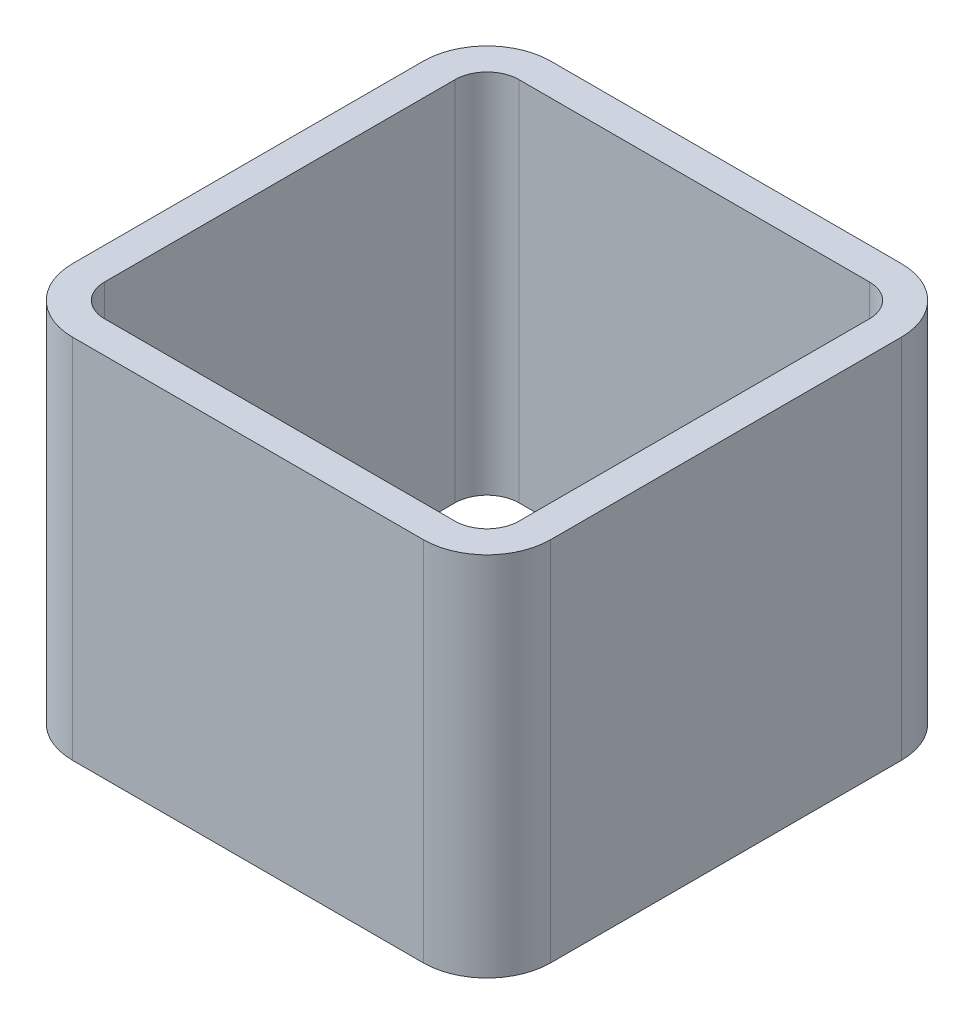
from build123d import *

# Parameters (mm, degrees)
EXTRUDE_1_DEPTH = 11.5


with BuildPart() as part:
    # 草图1 → 凸台-拉伸1 (new, symmetric)
    with BuildSketch(Plane(origin=(0, 0, 0), x_dir=(1, 0, 0), z_dir=(0, 1, 0))):
        with BuildLine():
            Line((-11, -15), (11, -15))
            ThreePointArc((11, -15), (13.828427125, -13.828427125), (15, -11))
            Line((15, -11), (15, 11))
            ThreePointArc((15, 11), (13.828427125, 13.828427125), (11, 15))
            Line((11, 15), (-11, 15))
            ThreePointArc((-11, 15), (-13.828427125, 13.828427125), (-15, 11))
            Line((-15, 11), (-15, -11))
            ThreePointArc((-15, -11), (-13.828427125, -13.828427125), (-11, -15))
        make_face()
        with BuildLine():
            Line((-11, -13), (11, -13))
            ThreePointArc((11, -13), (12.414213562, -12.414213562), (13, -11))
            Line((13, -11), (13, 11))
            ThreePointArc((13, 11), (12.414213562, 12.414213562), (11, 13))
            Line((11, 13), (-11, 13))
            ThreePointArc((-11, 13), (-12.414213562, 12.414213562), (-13, 11))
            Line((-13, 11), (-13, -11))
            ThreePointArc((-13, -11), (-12.414213562, -12.414213562), (-11, -13))
        make_face(mode=Mode.SUBTRACT)
    extrude(amount=EXTRUDE_1_DEPTH, both=True)


solid = part.part
